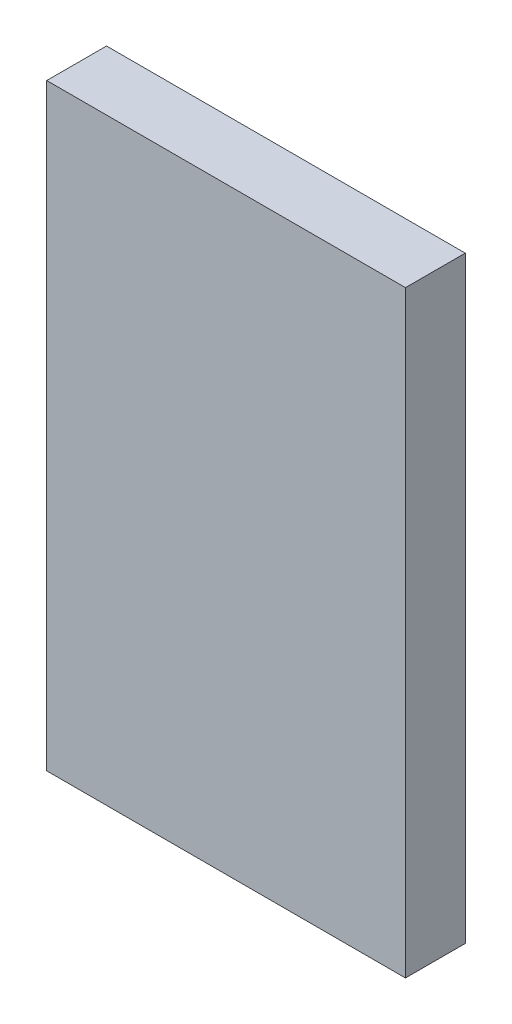
from build123d import *

# Parameters (mm, degrees)
SKETCH_1_W      = 90
SKETCH_1_H      = 150
EXTRUDE_1_DEPTH = 15


with BuildPart() as part:
    # Эскиз1 → Бобышка-Вытянуть1 (new body)
    with BuildSketch(Plane.XY):
        with Locations((45, -75)):
            Rectangle(SKETCH_1_W, SKETCH_1_H)
    extrude(amount=EXTRUDE_1_DEPTH)


solid = part.part
